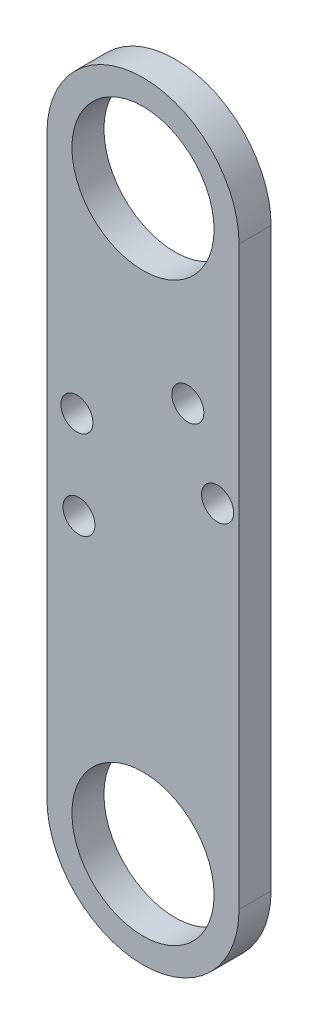
from build123d import *

# Parameters (mm, degrees)
SKETCH_1_R               = 11.1
EXTRUDE_1_DEPTH          = 72
SKETCH_2_W               = 62
SKETCH_2_H               = 70
SKETCH_2_H_2             = 67.94057246
CUT_EXTRUDE_1_DEPTH      = 70
EXTRUDE_2_DEPTH          = 62
EXTRUDE_3_DEPTH          = 62
CUT_EXTRUDE_3_DEPTH      = 130.811063026
CUT_EXTRUDE_3_DEPTH_BACK = 130.811063026
SKETCH_6_R               = 2.5
CUT_EXTRUDE_4_DEPTH      = 136.359998088
CUT_EXTRUDE_4_DEPTH_BACK = 136.359998088
SKETCH_7_W               = 62
SKETCH_7_H               = 120


with BuildPart() as part:
    # 草图1 → 凸台-拉伸1 (new body)
    with BuildSketch(Plane.XY):
        with BuildLine():
            Line((-15, 90), (-15, 0))
            ThreePointArc((-15, 0), (0, -15), (15, 0))
            Line((15, 0), (15, 90))
            ThreePointArc((15, 90), (0, 105), (-15, 90))
        make_face()
        Circle(SKETCH_1_R, mode=Mode.SUBTRACT)
        with Locations((0, 90)):
            Circle(SKETCH_1_R, mode=Mode.SUBTRACT)
    extrude(amount=EXTRUDE_1_DEPTH)

    # 草图2 → 切除-拉伸1 (cut)
    with BuildSketch(Plane.ZY.offset(15)):
        with Locations((36, 80)):
            Rectangle(SKETCH_2_W, SKETCH_2_H)
        with Locations((36, 11.02971377)):
            Rectangle(SKETCH_2_W, SKETCH_2_H_2)
    extrude(amount=-CUT_EXTRUDE_1_DEPTH, mode=Mode.SUBTRACT)


with BuildPart() as cut_extrude_1_piece_1:
    # of the separate pieces the step leaves, piece 1, a body of its own (cut_extrude_1_pieces)
    add(part.part.solids().sort_by_distance((15, 0, 0))[0])



with BuildPart() as cut_extrude_1_piece_2:
    # of the separate pieces the step leaves, piece 2, a body of its own (cut_extrude_1_pieces)
    add(part.part.solids().sort_by_distance((15, 0, 67))[0])


with BuildPart() as cut_extrude_1_piece_1_1:
    add(cut_extrude_1_piece_1.part)

    add(cut_extrude_1_piece_2.part)  # 凸台-拉伸2 merges 切除-拉伸1 piece 2
    # 草图4 → 凸台-拉伸2 (add)
    with BuildSketch(Plane(origin=(0, 0, 67), x_dir=(-1, 0, 0), z_dir=(0, 0, -1))):
        with BuildLine():
            Line((-4.490156776, 68.758657712), (15, 57.50601045))
            Line((15, 57.50601045), (36.319312502, 12.911360415))
            ThreePointArc((36.319312502, 12.911360415), (35.142094618, 9.577570071), (31.808304274, 10.754787955))
            Line((31.808304274, 10.754787955), (15, 45.913541163))
            Line((15, 45.913541163), (-9.509843224, 60.064305746))
            ThreePointArc((-9.509843224, 60.064305746), (-11.347175983, 66.921324953), (-4.490156776, 68.758657712))
        make_face()
    extrude(amount=EXTRUDE_2_DEPTH)

    # 草图5 → 凸台-拉伸3 (add)
    with BuildSketch(Plane(origin=(0, 0, 67), x_dir=(-1, 0, 0), z_dir=(0, 0, -1))):
        with BuildLine():
            Line((-30.017605928, 49.094069219), (-15, 60.919508718))
            Line((-15, 60.919508718), (12.5, 45.042376315))
            ThreePointArc((12.5, 45.042376315), (14.330127019, 38.212249296), (7.5, 36.382122277))
            Line((7.5, 36.382122277), (-15, 49.372503334))
            Line((-15, 49.372503334), (-27.615908762, 44.780688066))
            ThreePointArc((-27.615908762, 44.780688066), (-30.655195979, 45.913733224), (-30.017605928, 49.094069219))
        make_face()
    extrude(amount=EXTRUDE_3_DEPTH)

    # 草图6 → 切除-拉伸3 (cut, two sides: drawn at the far end of the back side and taken through both)
    with BuildSketch(Plane(origin=(0, 0, 67), x_dir=(-1, 0, 0), z_dir=(0, 0, -1)).offset(-CUT_EXTRUDE_3_DEPTH_BACK)):
        with Locations(Location((-7, 64.411481729, 0), (0, 0, 90))):
            Circle(SKETCH_6_R)
        with Locations(Location((-11.650635095, 53.212249296, 0), (0, 0, 90))):
            Circle(SKETCH_6_R)
        with Locations(Location((10, 40.712249296, 0), (0, 0, 90))):
            Circle(SKETCH_6_R)
        with Locations(Location((10.320508076, 54.411481729, 0), (0, 0, 90))):
            Circle(SKETCH_6_R)
    extrude(amount=CUT_EXTRUDE_3_DEPTH + CUT_EXTRUDE_3_DEPTH_BACK, mode=Mode.SUBTRACT)

    # 草图7 → 切除-拉伸4 (cut, two sides: drawn at the far end of the back side and taken through both)
    with BuildSketch(Plane.ZY.offset(15).offset(-CUT_EXTRUDE_4_DEPTH_BACK)):
        with Locations((36, 45)):
            Rectangle(SKETCH_7_W, SKETCH_7_H)
    extrude(amount=CUT_EXTRUDE_4_DEPTH + CUT_EXTRUDE_4_DEPTH_BACK, mode=Mode.SUBTRACT)


with BuildPart() as cut_extrude_4_piece_1:
    # of the separate pieces the step leaves, piece 1, a body of its own (cut_extrude_4_pieces)
    add(cut_extrude_1_piece_1_1.part.solids().sort_by_distance((-15, 90, 5))[0])


with BuildPart() as cut_extrude_4_piece_2:
    # of the separate pieces the step leaves, piece 2, a body of its own (cut_extrude_4_pieces)
    add(cut_extrude_1_piece_1_1.part.solids().sort_by_distance((15, 0, 67))[0])


solid = cut_extrude_4_piece_2.part
